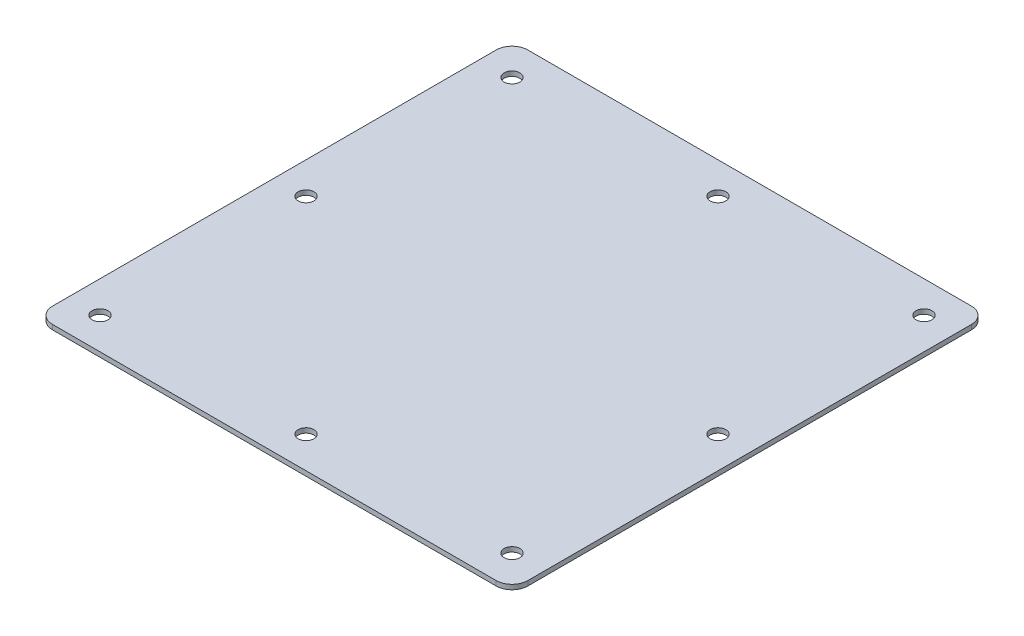
from build123d import *

# Parameters (mm, degrees)
SKETCH_1_W               = 300
SKETCH_1_H               = 300
EXTRUDE_1_DEPTH          = 3
FILLET_1_R               = 10
SKETCH_2_R               = 5
CUT_EXTRUDE_1_DEPTH      = 213.153246499
MIRROR_2_COPY_1_SKETCH_R = 5
MIRROR_2_COPY_1_DEPTH    = 213.153246499
SKETCH_3_R               = 5
CUT_EXTRUDE_2_DEPTH      = 213.153246499
SKETCH_4_R               = 5
CUT_EXTRUDE_3_DEPTH      = 213.153246499


with BuildPart() as part:
    # 草图1 → 凸台-拉伸1 (new body)
    with BuildSketch(Plane(origin=(0, 0, 0), x_dir=(1, 0, 0), z_dir=(0, 1, 0))):
        Rectangle(SKETCH_1_W, SKETCH_1_H)
    extrude(amount=EXTRUDE_1_DEPTH)

    # 圆角1
    fillet_1_edges = [part.edges().sort_by_distance(p)[0] for p in [
        (-150, 1.5, -150),
        (150, 1.5, -150),
        (150, 1.5, 150),
        (-150, 1.5, 150),
    ]]
    fillet(fillet_1_edges, radius=FILLET_1_R)

    # 草图2 → 切除-拉伸1 (cut, through all)
    with BuildSketch(Plane(origin=(0, 3, 0), x_dir=(1, 0, 0), z_dir=(0, 1, 0))):
        with Locations(Location((-130, 130, 0), (0, 0, 270))):
            Circle(SKETCH_2_R)
    cut_extrude_1 = extrude(amount=-CUT_EXTRUDE_1_DEPTH, mode=Mode.SUBTRACT)

    # 镜向1: 切除-拉伸1 across plane
    add(cut_extrude_1.mirror(Plane.XY), mode=Mode.SUBTRACT)

    # 镜向2: 切除-拉伸1 across plane
    add(cut_extrude_1.mirror(Plane(origin=(0, 0, 0), x_dir=(0, 0, 1), z_dir=(1, 0, 0))), mode=Mode.SUBTRACT)

    # 镜向2 copy 1 sketch → 镜向2 copy 1 (cut, through all)
    with BuildSketch(Plane(origin=(0, 3, 0), x_dir=(-1, 0, 0), z_dir=(0, 1, 0))):
        with Locations(Location((-130, 130, 0), (0, 0, 270))):
            Circle(MIRROR_2_COPY_1_SKETCH_R)
    extrude(amount=-MIRROR_2_COPY_1_DEPTH, mode=Mode.SUBTRACT)

    # 草图3 → 切除-拉伸2 (cut, through all)
    with BuildSketch(Plane(origin=(0, 3, 0), x_dir=(1, 0, 0), z_dir=(0, 1, 0))):
        with Locations(Location((-130, 0, 0), (0, 0, 270))):
            Circle(SKETCH_3_R)
    cut_extrude_2 = extrude(amount=-CUT_EXTRUDE_2_DEPTH, mode=Mode.SUBTRACT)

    # 镜向3: 切除-拉伸2 across plane
    add(cut_extrude_2.mirror(Plane(origin=(0, 0, 0), x_dir=(0, 0, 1), z_dir=(1, 0, 0))), mode=Mode.SUBTRACT)

    # 草图4 → 切除-拉伸3 (cut, through all)
    with BuildSketch(Plane(origin=(0, 3, 0), x_dir=(1, 0, 0), z_dir=(0, 1, 0))):
        with Locations(Location((0, 130, 0), (0, 0, 270))):
            Circle(SKETCH_4_R)
        with Locations(Location((0, -130, 0), (0, 0, 270))):
            Circle(SKETCH_4_R)
    extrude(amount=-CUT_EXTRUDE_3_DEPTH, mode=Mode.SUBTRACT)


solid = part.part
